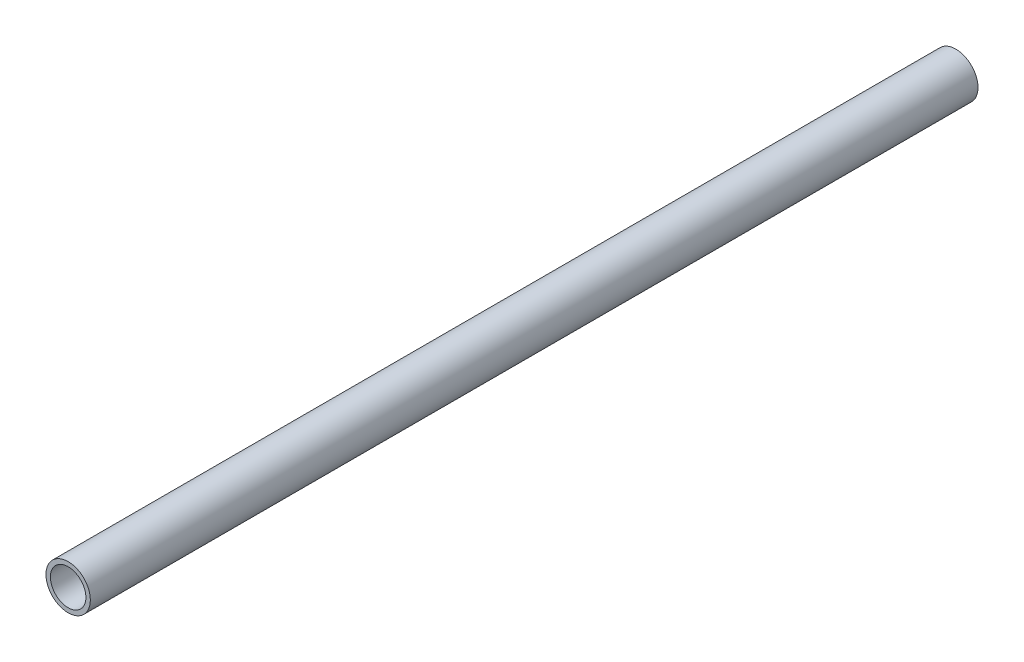
from build123d import *

# Parameters (mm, degrees)
SKETCH2_R           = 12.5
SKETCH2_R_2         = 10
EXTRUDE_THIN1_DEPTH = 250


with BuildPart() as part:
    # Sketch2 → Extrude-Thin1 (new, symmetric)
    with BuildSketch(Plane.XY):
        Circle(SKETCH2_R)
        Circle(SKETCH2_R_2, mode=Mode.SUBTRACT)
    extrude(amount=EXTRUDE_THIN1_DEPTH, both=True)


solid = part.part
